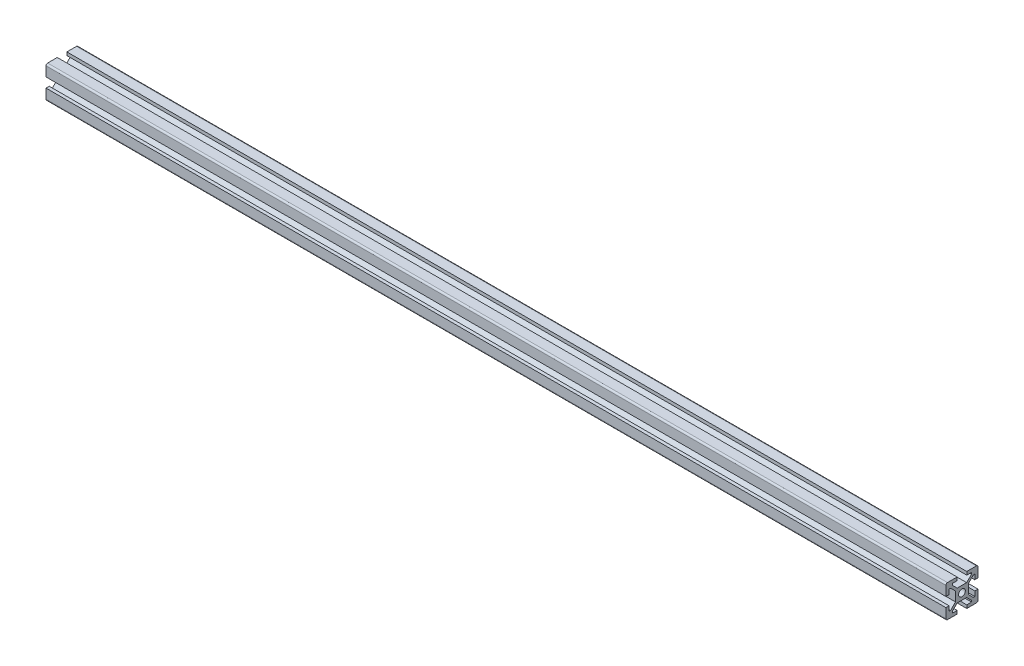
from build123d import *

# Parameters (mm, degrees)
SKETCH1_R                = 2.1
BOSS_EXTRUDE1_DEPTH      = 600
SKETCH_2_R               = 1.6
CUT_EXTRUDE_2_DEPTH      = 601.246615984
SKETCH_4_R               = 2.1
CUT_EXTRUDE_4_DEPTH      = 601.246616084
PATTERN_LINEAR_1_COUNT   = 3
PATTERN_LINEAR_1_PITCH   = 40
MIRROR_2_COPY_1_SKETCH_R = 2.1
MIRROR_2_COPY_1_DEPTH    = 601.246616084
MIRROR_2_COPY_2_SKETCH_R = 2.1
MIRROR_2_COPY_2_DEPTH    = 601.246616084
MIRROR_2_COPY_3_SKETCH_R = 2.1
MIRROR_2_COPY_3_DEPTH    = 601.246616084
SKETCH_5_R               = 2.1
CUT_EXTRUDE_5_DEPTH      = 601.246615984
PATTERN_LINEAR_3_COUNT   = 4
PATTERN_LINEAR_3_PITCH   = 55
MIRROR_3_COPY_1_SKETCH_R = 2.1
MIRROR_3_COPY_1_DEPTH    = 601.246615984
MIRROR_3_COPY_2_SKETCH_R = 2.1
MIRROR_3_COPY_2_DEPTH    = 601.246615984
MIRROR_3_COPY_3_SKETCH_R = 2.1
MIRROR_3_COPY_3_DEPTH    = 601.246615984
MIRROR_3_COPY_4_SKETCH_R = 2.1
MIRROR_3_COPY_4_DEPTH    = 601.246615984
SKETCH_6_W               = 25
SKETCH_6_H               = 25
CUT_EXTRUDE_6_DEPTH      = 20
SKETCH_8_W               = 25
SKETCH_8_H               = 25
CUT_EXTRUDE_8_DEPTH      = 20


with BuildPart() as part:
    # Sketch1 → Boss-Extrude1 (new body)
    with BuildSketch(Plane(origin=(0, 0, 0), x_dir=(0, 0, -1), z_dir=(1, 0, 0))):
        with BuildLine():
            Line((-10, 9), (-10, 3))
            Line((-10, 3), (-8, 3))
            Line((-8, 3), (-8, 6))
            Line((-8, 6), (-7.060660172, 6))
            Line((-7.060660172, 6), (-4, 2.939339828))
            Line((-4, 2.939339828), (-4, -2.939339828))
            Line((-4, -2.939339828), (-7.060660172, -6))
            Line((-7.060660172, -6), (-8, -6))
            Line((-8, -6), (-8, -3))
            Line((-8, -3), (-10, -3))
            Line((-10, -3), (-10, -9))
            ThreePointArc((-10, -9), (-9.707106781, -9.707106781), (-9, -10))
            Line((-9, -10), (-3, -10))
            Line((-3, -10), (-3, -8))
            Line((-3, -8), (-6, -8))
            Line((-6, -8), (-6, -7.060660172))
            Line((-6, -7.060660172), (-2.939339828, -4))
            Line((-2.939339828, -4), (2.939339828, -4))
            Line((2.939339828, -4), (6, -7.060660172))
            Line((6, -7.060660172), (6, -8))
            Line((6, -8), (3, -8))
            Line((3, -8), (3, -10))
            Line((3, -10), (9, -10))
            ThreePointArc((9, -10), (9.707106781, -9.707106781), (10, -9))
            Line((10, -9), (10, -3))
            Line((10, -3), (8, -3))
            Line((8, -3), (8, -6))
            Line((8, -6), (7.060660172, -6))
            Line((7.060660172, -6), (4, -2.939339828))
            Line((4, -2.939339828), (4, 2.939339828))
            Line((4, 2.939339828), (7.060660172, 6))
            Line((7.060660172, 6), (8, 6))
            Line((8, 6), (8, 3))
            Line((8, 3), (10, 3))
            Line((10, 3), (10, 9))
            ThreePointArc((10, 9), (9.707106781, 9.707106781), (9, 10))
            Line((9, 10), (3, 10))
            Line((3, 10), (3, 8))
            Line((3, 8), (6, 8))
            Line((6, 8), (6, 7.060660172))
            Line((6, 7.060660172), (2.939339828, 4))
            Line((2.939339828, 4), (-2.939339828, 4))
            Line((-2.939339828, 4), (-6, 7.060660172))
            Line((-6, 7.060660172), (-6, 8))
            Line((-6, 8), (-3, 8))
            Line((-3, 8), (-3, 10))
            Line((-3, 10), (-9, 10))
            ThreePointArc((-9, 10), (-9.707106781, 9.707106781), (-10, 9))
        make_face()
        Circle(SKETCH1_R, mode=Mode.SUBTRACT)
    extrude(amount=BOSS_EXTRUDE1_DEPTH)

    # 草图2 → 切除-拉伸2 (cut, through all)
    with BuildSketch(Plane.XY.offset(4)):
        with Locations((300, 0.06)):
            Circle(SKETCH_2_R)
    extrude(amount=-CUT_EXTRUDE_2_DEPTH, mode=Mode.SUBTRACT)

    # 草图4 → 切除-拉伸4 (cut, through all)
    with BuildSketch(Plane.XZ.offset(4)):
        with Locations((10, 0)):
            Circle(SKETCH_4_R)
    cut_extrude_4 = extrude(amount=-CUT_EXTRUDE_4_DEPTH, mode=Mode.SUBTRACT)

    # 阵列(线性)1: 切除-拉伸4 ×3
    with Locations(*[(i * PATTERN_LINEAR_1_PITCH, 0, 0) for i in range(1, PATTERN_LINEAR_1_COUNT)]):
        add(cut_extrude_4, mode=Mode.SUBTRACT)

    # 镜向2 copy 1 sketch → 镜向2 copy 1 (cut, through all)
    with BuildSketch(Plane(origin=(560, -4, 0), x_dir=(-1, 0, 0), z_dir=(0, -1, 0))):
        with Locations((10, 0)):
            Circle(MIRROR_2_COPY_1_SKETCH_R)
    extrude(amount=-MIRROR_2_COPY_1_DEPTH, mode=Mode.SUBTRACT)

    # 镜向2 copy 2 sketch → 镜向2 copy 2 (cut, through all)
    with BuildSketch(Plane(origin=(520, -4, 0), x_dir=(-1, 0, 0), z_dir=(0, -1, 0))):
        with Locations((10, 0)):
            Circle(MIRROR_2_COPY_2_SKETCH_R)
    extrude(amount=-MIRROR_2_COPY_2_DEPTH, mode=Mode.SUBTRACT)

    # 镜向2 copy 3 sketch → 镜向2 copy 3 (cut, through all)
    with BuildSketch(Plane(origin=(600, -4, 0), x_dir=(-1, 0, 0), z_dir=(0, -1, 0))):
        with Locations((10, 0)):
            Circle(MIRROR_2_COPY_3_SKETCH_R)
    extrude(amount=-MIRROR_2_COPY_3_DEPTH, mode=Mode.SUBTRACT)

    # 草图5 → 切除-拉伸5 (cut, through all)
    with BuildSketch(Plane.XZ.offset(4)):
        with Locations((315, -0.010660172)):
            Circle(SKETCH_5_R)
    cut_extrude_5 = extrude(amount=-CUT_EXTRUDE_5_DEPTH, mode=Mode.SUBTRACT)

    # 阵列(线性)3: 切除-拉伸5 ×4
    with Locations(*[(i * PATTERN_LINEAR_3_PITCH, 0, 0) for i in range(1, PATTERN_LINEAR_3_COUNT)]):
        add(cut_extrude_5, mode=Mode.SUBTRACT)

    # 镜向3 copy 1 sketch → 镜向3 copy 1 (cut, through all)
    with BuildSketch(Plane(origin=(545, -4, 0), x_dir=(-1, 0, 0), z_dir=(0, -1, 0))):
        with Locations((315, 0.010660172)):
            Circle(MIRROR_3_COPY_1_SKETCH_R)
    extrude(amount=-MIRROR_3_COPY_1_DEPTH, mode=Mode.SUBTRACT)

    # 镜向3 copy 2 sketch → 镜向3 copy 2 (cut, through all)
    with BuildSketch(Plane(origin=(490, -4, 0), x_dir=(-1, 0, 0), z_dir=(0, -1, 0))):
        with Locations((315, 0.010660172)):
            Circle(MIRROR_3_COPY_2_SKETCH_R)
    extrude(amount=-MIRROR_3_COPY_2_DEPTH, mode=Mode.SUBTRACT)

    # 镜向3 copy 3 sketch → 镜向3 copy 3 (cut, through all)
    with BuildSketch(Plane(origin=(435, -4, 0), x_dir=(-1, 0, 0), z_dir=(0, -1, 0))):
        with Locations((315, 0.010660172)):
            Circle(MIRROR_3_COPY_3_SKETCH_R)
    extrude(amount=-MIRROR_3_COPY_3_DEPTH, mode=Mode.SUBTRACT)

    # 镜向3 copy 4 sketch → 镜向3 copy 4 (cut, through all)
    with BuildSketch(Plane(origin=(600, -4, 0), x_dir=(-1, 0, 0), z_dir=(0, -1, 0))):
        with Locations((315, 0.010660172)):
            Circle(MIRROR_3_COPY_4_SKETCH_R)
    extrude(amount=-MIRROR_3_COPY_4_DEPTH, mode=Mode.SUBTRACT)

    # 草图6 → 切除-拉伸6 (cut)
    with BuildSketch(Plane.ZY):
        with Locations((-0.5, 2.5)):
            Rectangle(SKETCH_6_W, SKETCH_6_H)
    extrude(amount=-CUT_EXTRUDE_6_DEPTH, mode=Mode.SUBTRACT)

    # 草图8 → 切除-拉伸8 (cut)
    with BuildSketch(Plane(origin=(600, 0, 0), x_dir=(0, 0, -1), z_dir=(1, 0, 0))):
        Rectangle(SKETCH_8_W, SKETCH_8_H)
    extrude(amount=-CUT_EXTRUDE_8_DEPTH, mode=Mode.SUBTRACT)


solid = part.part
